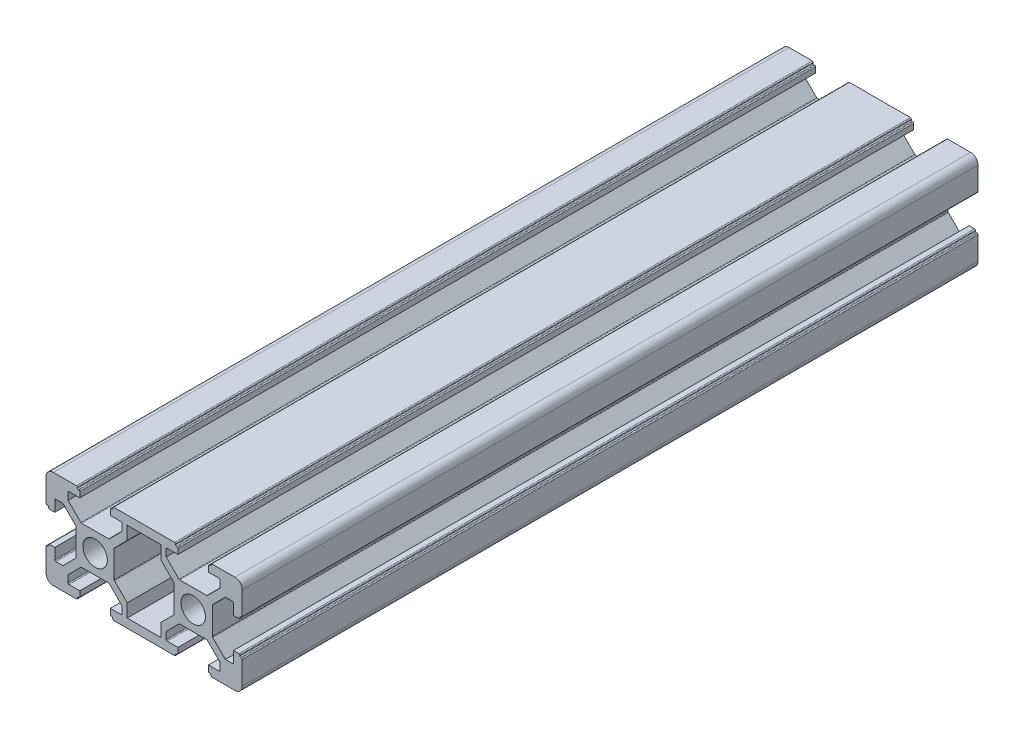
from build123d import *

# Parameters (mm, degrees)
BOSS_EXTRUDE1_DEPTH = 150
SKETCH2_R           = 2.5
CUT_EXTRUDE1_DEPTH  = 154.297097168


with BuildPart() as part:
    # Sketch1 → Boss-Extrude1 (new body)
    with BuildSketch(Plane.XY):
        with BuildLine():
            Line((-8.5, 10), (-3.8, 10))
            ThreePointArc((-3.8, 10), (-3.658578644, 9.941421356), (-3.6, 9.8))
            Line((-3.6, 9.8), (-3.6, 9.7))
            ThreePointArc((-3.6, 9.7), (-3.541421356, 9.558578644), (-3.4, 9.5))
            Line((-3.4, 9.5), (-3.3, 9.5))
            ThreePointArc((-3.3, 9.5), (-3.158578644, 9.441421356), (-3.1, 9.3))
            Line((-3.1, 9.3), (-3.1, 8.2))
            Line((-3.1, 8.2), (-5.3, 8.2))
            ThreePointArc((-5.3, 8.2), (-5.441421356, 8.141421356), (-5.5, 8))
            Line((-5.5, 8), (-5.5, 6.560660172))
            Line((-5.5, 6.560660172), (-2.897918472, 3.958578644))
            ThreePointArc((-2.897918472, 3.958578644), (-2.833033802, 3.915224093), (-2.756497116, 3.9))
            Line((-2.756497116, 3.9), (2.756497116, 3.9))
            ThreePointArc((2.756497116, 3.9), (2.833033802, 3.915224093), (2.897918472, 3.958578644))
            Line((2.897918472, 3.958578644), (5.5, 6.560660172))
            Line((5.5, 6.560660172), (5.5, 8))
            ThreePointArc((5.5, 8), (5.441421356, 8.141421356), (5.3, 8.2))
            Line((5.3, 8.2), (3.1, 8.2))
            Line((3.1, 8.2), (3.1, 9.3))
            ThreePointArc((3.1, 9.3), (3.158578644, 9.441421356), (3.3, 9.5))
            Line((3.3, 9.5), (3.4, 9.5))
            ThreePointArc((3.4, 9.5), (3.541421356, 9.558578644), (3.6, 9.7))
            Line((3.6, 9.7), (3.6, 9.8))
            ThreePointArc((3.6, 9.8), (3.658578644, 9.941421356), (3.8, 10))
            Line((3.8, 10), (8.5, 10))
            Line((8.5, 10), (11.5, 10))
            Line((11.5, 10), (16.2, 10))
            ThreePointArc((16.2, 10), (16.341421356, 9.941421356), (16.4, 9.8))
            Line((16.4, 9.8), (16.4, 9.7))
            ThreePointArc((16.4, 9.7), (16.458578644, 9.558578644), (16.6, 9.5))
            Line((16.6, 9.5), (16.7, 9.5))
            ThreePointArc((16.7, 9.5), (16.841421356, 9.441421356), (16.9, 9.3))
            Line((16.9, 9.3), (16.9, 8.2))
            Line((16.9, 8.2), (14.7, 8.2))
            ThreePointArc((14.7, 8.2), (14.558578644, 8.141421356), (14.5, 8))
            Line((14.5, 8), (14.5, 6.560660172))
            Line((14.5, 6.560660172), (17.102081528, 3.958578644))
            ThreePointArc((17.102081528, 3.958578644), (17.166966198, 3.915224093), (17.243502884, 3.9))
            Line((17.243502884, 3.9), (22.756497116, 3.9))
            ThreePointArc((22.756497116, 3.9), (22.833033802, 3.915224093), (22.897918472, 3.958578644))
            Line((22.897918472, 3.958578644), (25.5, 6.560660172))
            Line((25.5, 6.560660172), (25.5, 8))
            ThreePointArc((25.5, 8), (25.441421356, 8.141421356), (25.3, 8.2))
            Line((25.3, 8.2), (23.1, 8.2))
            Line((23.1, 8.2), (23.1, 9.3))
            ThreePointArc((23.1, 9.3), (23.158578644, 9.441421356), (23.3, 9.5))
            Line((23.3, 9.5), (23.4, 9.5))
            ThreePointArc((23.4, 9.5), (23.541421356, 9.558578644), (23.6, 9.7))
            Line((23.6, 9.7), (23.6, 9.8))
            ThreePointArc((23.6, 9.8), (23.658578644, 9.941421356), (23.8, 10))
            Line((23.8, 10), (28.5, 10))
            ThreePointArc((28.5, 10), (29.560660172, 9.560660172), (30, 8.5))
            Line((30, 8.5), (30, 3.8))
            ThreePointArc((30, 3.8), (29.941421356, 3.658578644), (29.8, 3.6))
            Line((29.8, 3.6), (29.7, 3.6))
            ThreePointArc((29.7, 3.6), (29.558578644, 3.541421356), (29.5, 3.4))
            Line((29.5, 3.4), (29.5, 3.3))
            ThreePointArc((29.5, 3.3), (29.441421356, 3.158578644), (29.3, 3.1))
            Line((29.3, 3.1), (28.2, 3.1))
            Line((28.2, 3.1), (28.2, 5.3))
            ThreePointArc((28.2, 5.3), (28.141421356, 5.441421356), (28, 5.5))
            Line((28, 5.5), (26.560660172, 5.5))
            Line((26.560660172, 5.5), (23.958578644, 2.897918472))
            ThreePointArc((23.958578644, 2.897918472), (23.915224093, 2.833033802), (23.9, 2.756497116))
            Line((23.9, 2.756497116), (23.9, -2.756497116))
            ThreePointArc((23.9, -2.756497116), (23.915224093, -2.833033802), (23.958578644, -2.897918472))
            Line((23.958578644, -2.897918472), (26.560660172, -5.5))
            Line((26.560660172, -5.5), (28, -5.5))
            ThreePointArc((28, -5.5), (28.141421356, -5.441421356), (28.2, -5.3))
            Line((28.2, -5.3), (28.2, -3.1))
            Line((28.2, -3.1), (29.3, -3.1))
            ThreePointArc((29.3, -3.1), (29.441421356, -3.158578644), (29.5, -3.3))
            Line((29.5, -3.3), (29.5, -3.4))
            ThreePointArc((29.5, -3.4), (29.558578644, -3.541421356), (29.7, -3.6))
            Line((29.7, -3.6), (29.8, -3.6))
            ThreePointArc((29.8, -3.6), (29.941421356, -3.658578644), (30, -3.8))
            Line((30, -3.8), (30, -8.5))
            ThreePointArc((30, -8.5), (29.560660172, -9.560660172), (28.5, -10))
            Line((28.5, -10), (23.8, -10))
            ThreePointArc((23.8, -10), (23.658578644, -9.941421356), (23.6, -9.8))
            Line((23.6, -9.8), (23.6, -9.7))
            ThreePointArc((23.6, -9.7), (23.541421356, -9.558578644), (23.4, -9.5))
            Line((23.4, -9.5), (23.3, -9.5))
            ThreePointArc((23.3, -9.5), (23.158578644, -9.441421356), (23.1, -9.3))
            Line((23.1, -9.3), (23.1, -8.2))
            Line((23.1, -8.2), (25.3, -8.2))
            ThreePointArc((25.3, -8.2), (25.441421356, -8.141421356), (25.5, -8))
            Line((25.5, -8), (25.5, -6.560660172))
            Line((25.5, -6.560660172), (22.897918472, -3.958578644))
            ThreePointArc((22.897918472, -3.958578644), (22.833033802, -3.915224093), (22.756497116, -3.9))
            Line((22.756497116, -3.9), (17.243502884, -3.9))
            ThreePointArc((17.243502884, -3.9), (17.166966198, -3.915224093), (17.102081528, -3.958578644))
            Line((17.102081528, -3.958578644), (14.5, -6.560660172))
            Line((14.5, -6.560660172), (14.5, -8))
            ThreePointArc((14.5, -8), (14.558578644, -8.141421356), (14.7, -8.2))
            Line((14.7, -8.2), (16.9, -8.2))
            Line((16.9, -8.2), (16.9, -9.3))
            ThreePointArc((16.9, -9.3), (16.841421356, -9.441421356), (16.7, -9.5))
            Line((16.7, -9.5), (16.6, -9.5))
            ThreePointArc((16.6, -9.5), (16.458578644, -9.558578644), (16.4, -9.7))
            Line((16.4, -9.7), (16.4, -9.8))
            ThreePointArc((16.4, -9.8), (16.341421356, -9.941421356), (16.2, -10))
            Line((16.2, -10), (11.5, -10))
            Line((11.5, -10), (8.5, -10))
            Line((8.5, -10), (3.8, -10))
            ThreePointArc((3.8, -10), (3.658578644, -9.941421356), (3.6, -9.8))
            Line((3.6, -9.8), (3.6, -9.7))
            ThreePointArc((3.6, -9.7), (3.541421356, -9.558578644), (3.4, -9.5))
            Line((3.4, -9.5), (3.3, -9.5))
            ThreePointArc((3.3, -9.5), (3.158578644, -9.441421356), (3.1, -9.3))
            Line((3.1, -9.3), (3.1, -8.2))
            Line((3.1, -8.2), (5.3, -8.2))
            ThreePointArc((5.3, -8.2), (5.441421356, -8.141421356), (5.5, -8))
            Line((5.5, -8), (5.5, -6.560660172))
            Line((5.5, -6.560660172), (2.897918472, -3.958578644))
            ThreePointArc((2.897918472, -3.958578644), (2.833033802, -3.915224093), (2.756497116, -3.9))
            Line((2.756497116, -3.9), (-2.756497116, -3.9))
            ThreePointArc((-2.756497116, -3.9), (-2.833033802, -3.915224093), (-2.897918472, -3.958578644))
            Line((-2.897918472, -3.958578644), (-5.5, -6.560660172))
            Line((-5.5, -6.560660172), (-5.5, -8))
            ThreePointArc((-5.5, -8), (-5.441421356, -8.141421356), (-5.3, -8.2))
            Line((-5.3, -8.2), (-3.1, -8.2))
            Line((-3.1, -8.2), (-3.1, -9.3))
            ThreePointArc((-3.1, -9.3), (-3.158578644, -9.441421356), (-3.3, -9.5))
            Line((-3.3, -9.5), (-3.4, -9.5))
            ThreePointArc((-3.4, -9.5), (-3.541421356, -9.558578644), (-3.6, -9.7))
            Line((-3.6, -9.7), (-3.6, -9.8))
            ThreePointArc((-3.6, -9.8), (-3.658578644, -9.941421356), (-3.8, -10))
            Line((-3.8, -10), (-8.5, -10))
            ThreePointArc((-8.5, -10), (-9.560660172, -9.560660172), (-10, -8.5))
            Line((-10, -8.5), (-10, -3.8))
            ThreePointArc((-10, -3.8), (-9.941421356, -3.658578644), (-9.8, -3.6))
            Line((-9.8, -3.6), (-9.7, -3.6))
            ThreePointArc((-9.7, -3.6), (-9.558578644, -3.541421356), (-9.5, -3.4))
            Line((-9.5, -3.4), (-9.5, -3.3))
            ThreePointArc((-9.5, -3.3), (-9.441421356, -3.158578644), (-9.3, -3.1))
            Line((-9.3, -3.1), (-8.2, -3.1))
            Line((-8.2, -3.1), (-8.2, -5.3))
            ThreePointArc((-8.2, -5.3), (-8.141421356, -5.441421356), (-8, -5.5))
            Line((-8, -5.5), (-6.560660172, -5.5))
            Line((-6.560660172, -5.5), (-3.958578644, -2.897918472))
            ThreePointArc((-3.958578644, -2.897918472), (-3.915224093, -2.833033802), (-3.9, -2.756497116))
            Line((-3.9, -2.756497116), (-3.9, 2.756497116))
            ThreePointArc((-3.9, 2.756497116), (-3.915224093, 2.833033802), (-3.958578644, 2.897918472))
            Line((-3.958578644, 2.897918472), (-6.560660172, 5.5))
            Line((-6.560660172, 5.5), (-8, 5.5))
            ThreePointArc((-8, 5.5), (-8.141421356, 5.441421356), (-8.2, 5.3))
            Line((-8.2, 5.3), (-8.2, 3.1))
            Line((-8.2, 3.1), (-9.3, 3.1))
            ThreePointArc((-9.3, 3.1), (-9.441421356, 3.158578644), (-9.5, 3.3))
            Line((-9.5, 3.3), (-9.5, 3.4))
            ThreePointArc((-9.5, 3.4), (-9.558578644, 3.541421356), (-9.7, 3.6))
            Line((-9.7, 3.6), (-9.8, 3.6))
            ThreePointArc((-9.8, 3.6), (-9.941421356, 3.658578644), (-10, 3.8))
            Line((-10, 3.8), (-10, 8.5))
            ThreePointArc((-10, 8.5), (-9.560660172, 9.560660172), (-8.5, 10))
        make_face()
        with BuildLine():
            Line((3.9, 2.756497116), (3.9, -2.756497116))
            ThreePointArc((3.9, -2.756497116), (3.915224093, -2.833033802), (3.958578644, -2.897918472))
            Line((3.958578644, -2.897918472), (6.560660172, -5.5))
            Line((6.560660172, -5.5), (6.560660172, -8.2))
            Line((6.560660172, -8.2), (13.439339828, -8.2))
            Line((13.439339828, -8.2), (13.439339828, -5.5))
            Line((13.439339828, -5.5), (16.041421356, -2.897918472))
            ThreePointArc((16.041421356, -2.897918472), (16.084775907, -2.833033802), (16.1, -2.756497116))
            Line((16.1, -2.756497116), (16.1, 2.756497116))
            ThreePointArc((16.1, 2.756497116), (16.084775907, 2.833033802), (16.041421356, 2.897918472))
            Line((16.041421356, 2.897918472), (13.439339828, 5.5))
            Line((13.439339828, 5.5), (13.439339828, 8.2))
            Line((13.439339828, 8.2), (6.560660172, 8.2))
            Line((6.560660172, 8.2), (6.560660172, 5.5))
            Line((6.560660172, 5.5), (3.958578644, 2.897918472))
            ThreePointArc((3.958578644, 2.897918472), (3.915224093, 2.833033802), (3.9, 2.756497116))
        make_face(mode=Mode.SUBTRACT)
    extrude(amount=BOSS_EXTRUDE1_DEPTH)

    # Sketch2 → Cut-Extrude1 (cut, through all)
    with BuildSketch(Plane.XY.offset(150)):
        Circle(SKETCH2_R)
        with Locations(Location((20, 0, 0), (0, 0, 180))):
            Circle(SKETCH2_R)
    extrude(amount=-CUT_EXTRUDE1_DEPTH, mode=Mode.SUBTRACT)


solid = part.part
